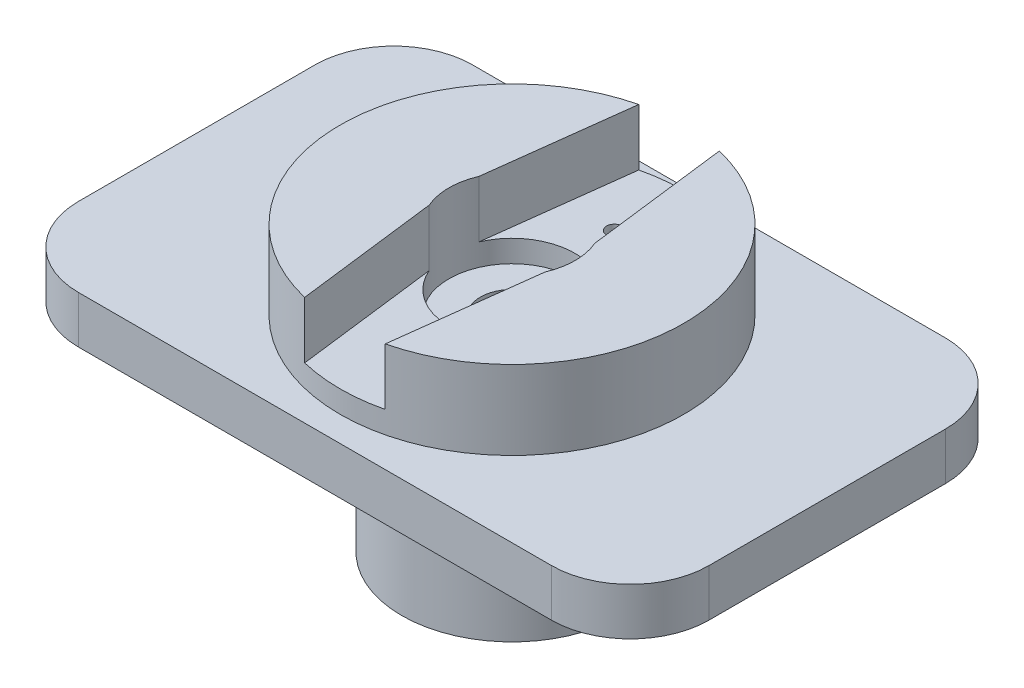
from build123d import *

# Parameters (mm, degrees)
SKETCH_1_W          = 40
SKETCH_1_H          = 25
EXTRUDE_1_DEPTH     = 3
SKETCH_2_R          = 10.9
EXTRUDE_2_DEPTH     = 5
SKETCH_3_R          = 4
CUT_EXTRUDE_1_DEPTH = 25.904818811
CUT_EXTRUDE_2_DEPTH = 3.6
SKETCH_5_R          = 0.5
CUT_EXTRUDE_3_DEPTH = 4
FILLET_1_R          = 5
FILLET_2_R          = 5
FILLET_3_R          = 5
FILLET_4_R          = 5
SKETCH_6_R          = 7
SKETCH_6_R_2        = 3
EXTRUDE_3_DEPTH     = 10
SKETCH_7_R          = 4
SKETCH_7_R_2        = 2
EXTRUDE_4_DEPTH     = 3


with BuildPart() as part:
    # 草图1 → 凸台-拉伸1 (new body)
    with BuildSketch(Plane(origin=(0, 0, 0), x_dir=(1, 0, 0), z_dir=(0, 1, 0))):
        Rectangle(SKETCH_1_W, SKETCH_1_H)
    extrude(amount=EXTRUDE_1_DEPTH)

    # 草图2 → 凸台-拉伸2 (add)
    with BuildSketch(Plane(origin=(0, 3, 0), x_dir=(1, 0, 0), z_dir=(0, 1, 0))):
        with Locations(Location((0, 0, 0), (0, 0, 270))):
            Circle(SKETCH_2_R)
    extrude(amount=EXTRUDE_2_DEPTH)

    # 草图3 → 切除-拉伸1 (cut, through all)
    with BuildSketch(Plane.XZ):
        with Locations(Location((0, 0, 0), (0, 0, 270))):
            Circle(SKETCH_3_R)
    extrude(amount=-CUT_EXTRUDE_1_DEPTH, mode=Mode.SUBTRACT)

    # 草图4 → 切除-拉伸2 (cut)
    with BuildSketch(Plane(origin=(0, 8, 0), x_dir=(1, 0, 0), z_dir=(0, 1, 0))):
        Polygon((3.674809939, -1.579801226), (2.341337155, -12.320336373), (-2.341337155, -12.320336373), (-3.674809939, -1.579801226), align=None)
        Polygon((-3.674809939, 1.579801226), (-2.341337155, 12.320336373), (2.341337155, 12.320336373), (3.674809939, 1.579801226), align=None)
    extrude(amount=-CUT_EXTRUDE_2_DEPTH, mode=Mode.SUBTRACT)

    # 草图5 → 切除-拉伸3 (cut)
    with BuildSketch(Plane(origin=(0, 4.4, 0), x_dir=(1, 0, 0), z_dir=(0, 1, 0))):
        with Locations(Location((0, -6.5, 0), (0, 0, 270))):
            Circle(SKETCH_5_R)
        with Locations(Location((0, 6.5, 0), (0, 0, 270))):
            Circle(SKETCH_5_R)
    extrude(amount=-CUT_EXTRUDE_3_DEPTH, mode=Mode.SUBTRACT)

    # 圆角1
    fillet_1_edges = [part.edges().sort_by_distance(p)[0] for p in [
        (20, 1.5, 12.5),
    ]]
    fillet(fillet_1_edges, radius=FILLET_1_R)

    # 圆角2
    fillet_2_edges = [part.edges().sort_by_distance(p)[0] for p in [
        (-20, 1.5, 12.5),
    ]]
    fillet(fillet_2_edges, radius=FILLET_2_R)

    # 圆角3
    fillet_3_edges = [part.edges().sort_by_distance(p)[0] for p in [
        (-20, 1.5, -12.5),
    ]]
    fillet(fillet_3_edges, radius=FILLET_3_R)

    # 圆角4
    fillet_4_edges = [part.edges().sort_by_distance(p)[0] for p in [
        (20, 1.5, -12.5),
    ]]
    fillet(fillet_4_edges, radius=FILLET_4_R)

    # 草图6 → 凸台-拉伸3 (add)
    with BuildSketch(Plane(origin=(0, 0, 0), x_dir=(-1, 0, 0), z_dir=(0, -1, 0))):
        with Locations(Location((0, 0, 0), (0, 0, 270))):
            Circle(SKETCH_6_R)
        with Locations(Location((0, 0, 0), (0, 0, 90))):
            Circle(SKETCH_6_R_2, mode=Mode.SUBTRACT)
    extrude(amount=EXTRUDE_3_DEPTH)

    # 草图7 → 凸台-拉伸4 (add)
    with BuildSketch(Plane(origin=(0, 0, 0), x_dir=(1, 0, 0), z_dir=(0, 1, 0))):
        with Locations(Location((0, 0, 0), (0, 0, 156.73712516))):
            Circle(SKETCH_7_R)
        with Locations(Location((0, 0, 0), (0, 0, 270))):
            Circle(SKETCH_7_R_2, mode=Mode.SUBTRACT)
    extrude(amount=EXTRUDE_4_DEPTH)


solid = part.part
